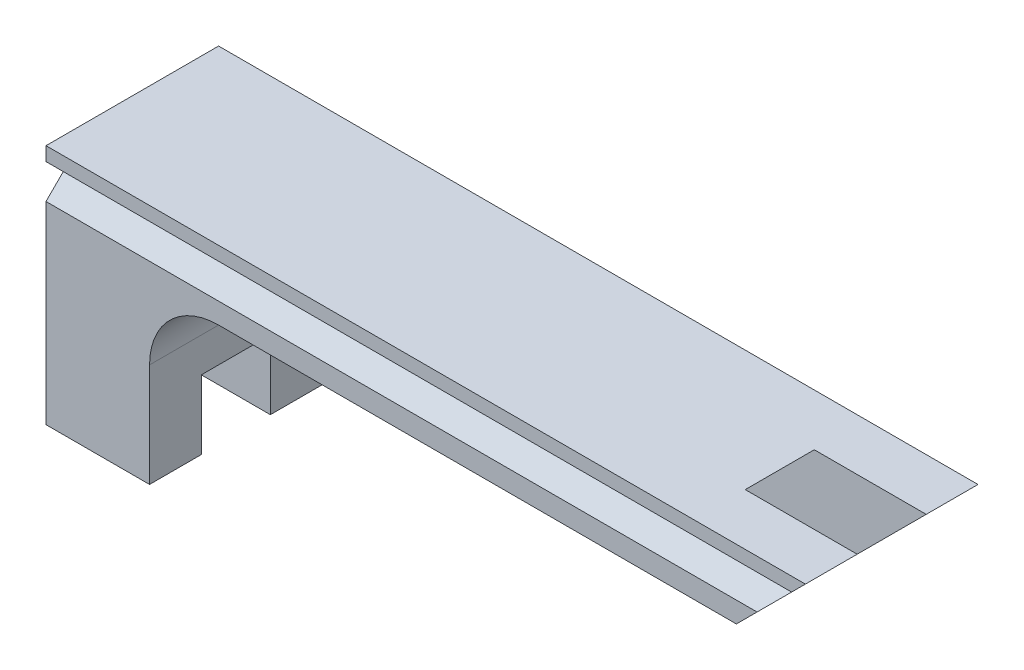
from build123d import *

# Parameters (mm, degrees)
SKETCH_1_W          = 220
SKETCH_1_H          = 70
EXTRUDE_1_DEPTH     = 30
SKETCH_2_W          = 190
SKETCH_2_H          = 50
CUT_EXTRUDE_1_DEPTH = 30
SKETCH_3_W          = 20
SKETCH_3_H          = 40
CUT_EXTRUDE_2_DEPTH = 30
CUT_EXTRUDE_3_DEPTH = 30
SKETCH_5_W          = 20
SKETCH_5_H          = 60
CUT_EXTRUDE_4_DEPTH = 30
SKETCH_6_W          = 20
SKETCH_6_H          = 20
CUT_EXTRUDE_5_DEPTH = 30
SKETCH_7_W          = 20
SKETCH_7_H          = 20
CUT_EXTRUDE_6_DEPTH = 10
FILLET_1_R          = 20
EXTRUDE_2_DEPTH     = 22
EXTRUDE_3_DEPTH     = 10
EXTRUDE_START       = 10
EXTRUDE_4_DEPTH     = 10
CUT_EXTRUDE_7_DEPTH = 10
CUT_EXTRUDE_8_DEPTH = 299


with BuildPart() as part:
    # 草图1 → 凸台-拉伸1 (new body)
    with BuildSketch(Plane.XY):
        Rectangle(SKETCH_1_W, SKETCH_1_H)
    extrude(amount=EXTRUDE_1_DEPTH)

    # 草图2 → 切除-拉伸1 (cut)
    with BuildSketch(Plane.XY.offset(30)):
        with Locations((15, -10)):
            Rectangle(SKETCH_2_W, SKETCH_2_H)
    extrude(amount=-CUT_EXTRUDE_1_DEPTH, mode=Mode.SUBTRACT)

    # 草图3 → 切除-拉伸2 (cut)
    with BuildSketch(Plane(origin=(-80, 0, 0), x_dir=(0, 0, -1), z_dir=(1, 0, 0))):
        with Locations((-15, -35)):
            Rectangle(SKETCH_3_W, SKETCH_3_H)
    extrude(amount=-CUT_EXTRUDE_2_DEPTH, mode=Mode.SUBTRACT)

    # 草图4 → 切除-拉伸3 (cut)
    with BuildSketch(Plane.XY.offset(30)):
        Polygon((110, 35), (90, 15), (110, 15), align=None)
    extrude(amount=-CUT_EXTRUDE_3_DEPTH, mode=Mode.SUBTRACT)

    # 草图5 → 切除-拉伸4 (cut)
    with BuildSketch(Plane(origin=(37.5, -37.5, 0), x_dir=(0, 0, -1), z_dir=(0.7071067811865536, -0.7071067811865415, 0))):
        with Locations((-15, 102.530483272)):
            Rectangle(SKETCH_5_W, SKETCH_5_H)
    extrude(amount=-CUT_EXTRUDE_4_DEPTH, mode=Mode.SUBTRACT)

    # 草图6 → 切除-拉伸5 (cut)
    with BuildSketch(Plane(origin=(0, 35, 0), x_dir=(1, 0, 0), z_dir=(0, 1, 0))):
        with Locations((77.573593129, -15)):
            Rectangle(SKETCH_6_W, SKETCH_6_H)
    extrude(amount=-CUT_EXTRUDE_5_DEPTH, mode=Mode.SUBTRACT)

    # 草图7 → 切除-拉伸6 (cut)
    with BuildSketch(Plane(origin=(67.573593129, 0, 0), x_dir=(0, 0, -1), z_dir=(1, 0, 0))):
        with Locations((-15, 25)):
            Rectangle(SKETCH_7_W, SKETCH_7_H)
    extrude(amount=-CUT_EXTRUDE_6_DEPTH, mode=Mode.SUBTRACT)

    # 圆角1
    fillet_1_edges = [part.edges().sort_by_distance(p)[0] for p in [
        (-80, 15, 15),
    ]]
    fillet(fillet_1_edges, radius=FILLET_1_R)

    # 草图8 → 凸台-拉伸2 (add)
    with BuildSketch(Plane(origin=(0, 0, 25), x_dir=(-1, 0, 0), z_dir=(0, 0, -1))):
        Polygon((-57.573593129, 15), (-77.573593129, 35), (-57.573593129, 35), align=None)
    extrude(amount=EXTRUDE_2_DEPTH)

    # 草图9 → 凸台-拉伸3 (add)
    with BuildSketch(Plane.XY.offset(30)):
        with BuildLine():
            Line((90, 15), (110, 35))
            Line((110, 35), (-110, 35))
            Line((-110, 35), (-110, -35))
            Line((-110, -35), (-80, -35))
            Line((-80, -35), (-80, -5))
            ThreePointArc((-80, -5), (-74.142135624, 9.142135624), (-60, 15))
            Line((-60, 15), (90, 15))
        make_face()
    extrude(amount=EXTRUDE_3_DEPTH)

    # 草图10 → 凸台-拉伸4 (add)
    with BuildSketch(Plane(origin=(0, 0, 0), x_dir=(-1, 0, 0), z_dir=(0, 0, -1)).offset(EXTRUDE_START)):
        with BuildLine():
            Line((110, 35), (-110, 35))
            Line((-110, 35), (-90, 15))
            Line((-90, 15), (60, 15))
            ThreePointArc((60, 15), (74.142135624, 9.142135624), (80, -5))
            Line((80, -5), (80, -35))
            Line((80, -35), (110, -35))
            Line((110, -35), (110, 35))
        make_face()
    extrude(amount=-EXTRUDE_4_DEPTH)

    # 草图11 → 切除-拉伸7 (cut)
    with BuildSketch(Plane.XZ.offset(-15)):
        with BuildLine():
            Line((-47.5, 25), (37.5, 25))
            ThreePointArc((37.5, 25), (47.5, 15), (37.5, 5))
            Line((37.5, 5), (-47.5, 5))
            ThreePointArc((-47.5, 5), (-57.5, 15), (-47.5, 25))
        make_face()
    extrude(amount=-CUT_EXTRUDE_7_DEPTH, mode=Mode.SUBTRACT)

    # 草图12 → 切除-拉伸8 (cut)
    with BuildSketch(Plane.ZY.offset(110)):
        Polygon((-10, 31), (-5, 26), (-10, 21), align=None)
        Polygon((40, 31), (35, 26), (40, 21), align=None)
    extrude(amount=-CUT_EXTRUDE_8_DEPTH, mode=Mode.SUBTRACT)


solid = part.part
